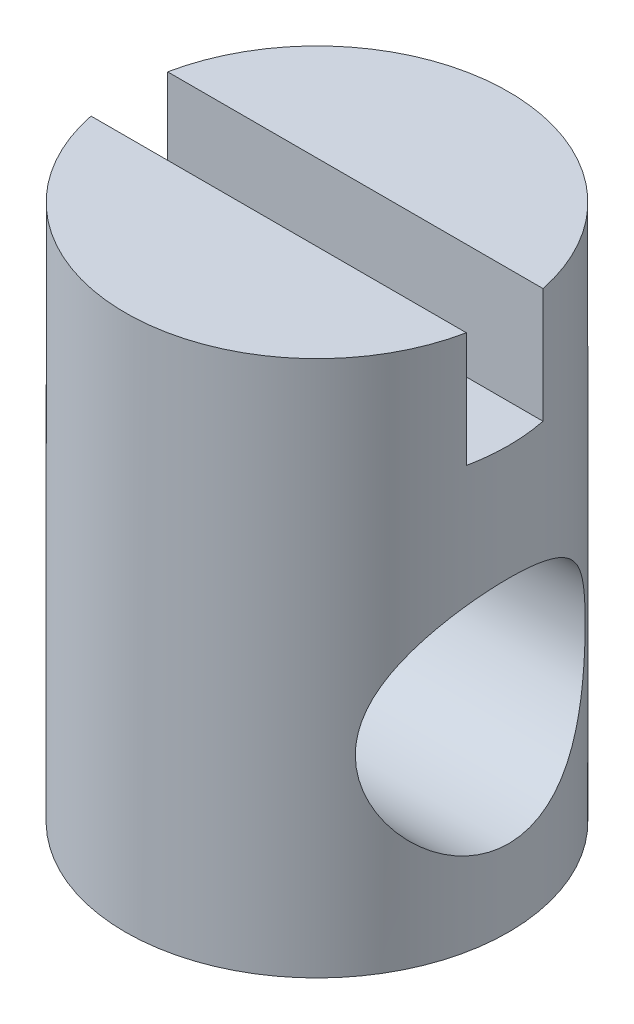
from build123d import *

# Parameters (mm, degrees)
SKETCH_1_R               = 5
EXTRUDE_1_DEPTH          = 14
SKETCH_2_W               = 13.996795202
SKETCH_2_H               = 2
CUT_EXTRUDE_1_DEPTH      = 3
CUT_EXTRUDE_2_DEPTH      = 13
CUT_EXTRUDE_2_DEPTH_BACK = 13
SKETCH_3_R               = 3


with BuildPart() as part:
    # 스케치1 → 보스-돌출1 (new body)
    with BuildSketch(Plane(origin=(0, 0, 0), x_dir=(1, 0, 0), z_dir=(0, 1, 0))):
        Circle(SKETCH_1_R)
    extrude(amount=EXTRUDE_1_DEPTH)

    # 스케치2 → 컷-돌출1 (cut)
    with BuildSketch(Plane(origin=(0, 14, 0), x_dir=(1, 0, 0), z_dir=(0, 1, 0))):
        Rectangle(SKETCH_2_W, SKETCH_2_H)
    extrude(amount=-CUT_EXTRUDE_1_DEPTH, mode=Mode.SUBTRACT)

    # 스케치3 → 컷-돌출2 (cut, two sides: drawn at the far end of the back side and taken through both)
    with BuildSketch(Plane(origin=(0, 0, 0), x_dir=(0, 0, -1), z_dir=(1, 0, 0)).offset(-CUT_EXTRUDE_2_DEPTH_BACK)):
        with Locations((0, 5)):
            Circle(SKETCH_3_R)
    extrude(amount=CUT_EXTRUDE_2_DEPTH + CUT_EXTRUDE_2_DEPTH_BACK, mode=Mode.SUBTRACT)


solid = part.part
